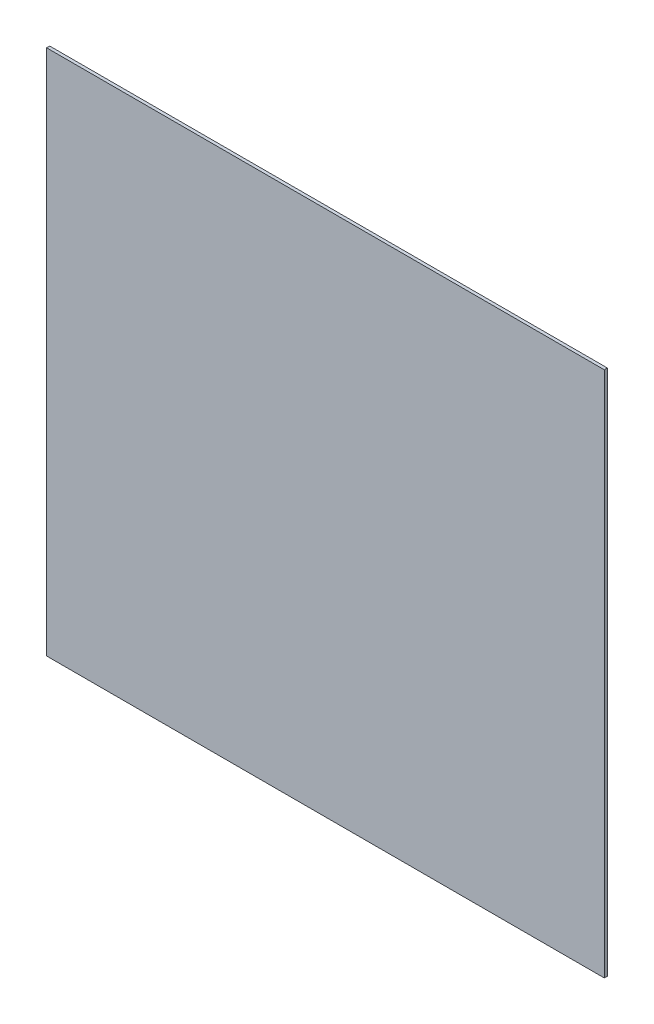
from build123d import *

# Parameters (mm, degrees)
SKETCH1_W           = 540
SKETCH1_H           = 510
BOSS_EXTRUDE1_DEPTH = 3


with BuildPart() as part:
    # Sketch1 → Boss-Extrude1 (new body)
    with BuildSketch(Plane.XY):
        Rectangle(SKETCH1_W, SKETCH1_H)
    extrude(amount=BOSS_EXTRUDE1_DEPTH)


solid = part.part
